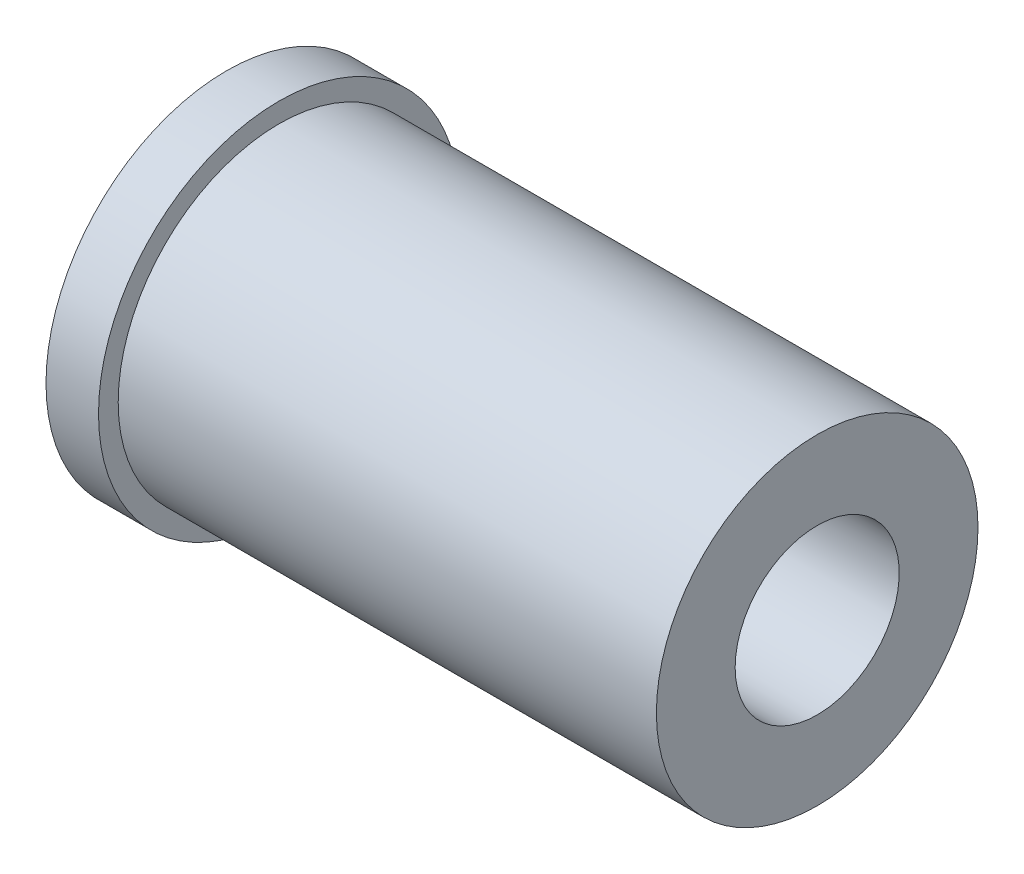
from build123d import *

# Parameters (mm, degrees)
HOLE_WIZARD_M3_1_D = 2.5


with BuildPart() as part:
    # 草图1 → 旋转1 (revolve)
    with BuildSketch(Plane.XY, mode=Mode.PRIVATE) as revolve_1_sk:
        Polygon((0, 1.5), (0, 2.75), (0.8, 2.75), (0.8, 2.45), (9, 2.45), (9, 0), (3.5, 0), (3.5, 1.5), align=None)
    revolve(revolve_1_sk.sketch.rotate(Axis((0, 0, 0), (1, 0, 0)), 90), axis=Axis((0, 0, 0), (1, 0, 0)))

    # M3 螺纹孔1 (through all)
    with Locations(Plane.ZY.offset(-3.5)):
        with Locations((0, 0)):
            Hole(HOLE_WIZARD_M3_1_D / 2)


solid = part.part
